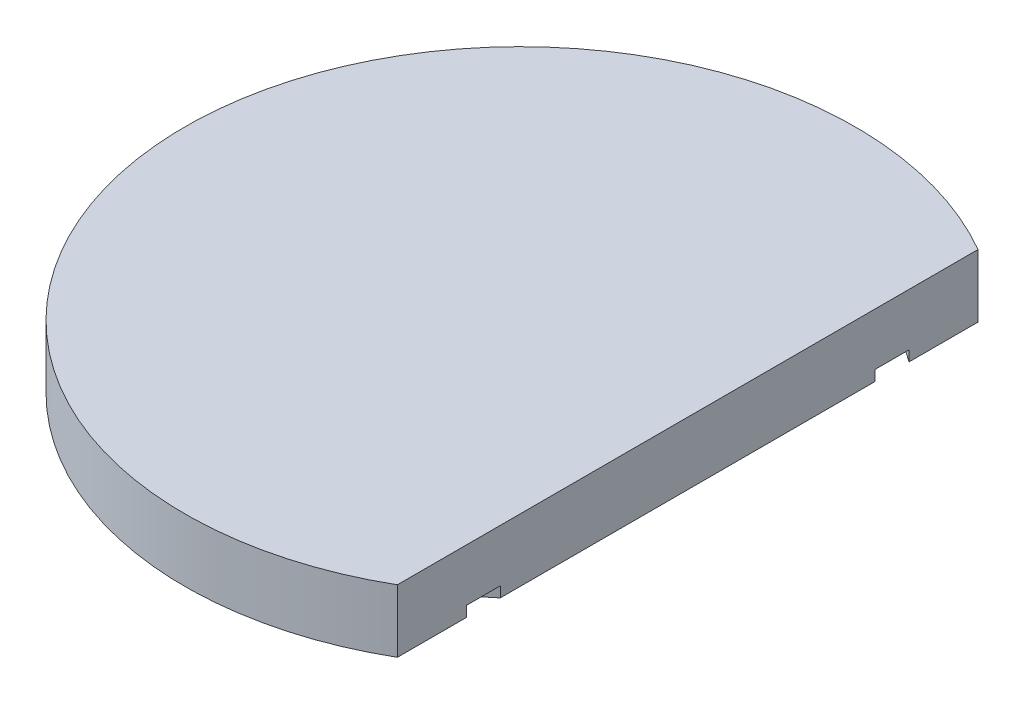
from build123d import *

# Parameters (mm, degrees)
BOSS_EXTRUDE1_DEPTH = 19.05
SKETCH2_R           = 84.1375
SKETCH2_R_2         = 76.2
CUT_EXTRUDE1_DEPTH  = 3.175


with BuildPart() as part:
    # Sketch1 → Boss-Extrude1 (new body)
    with BuildSketch(Plane(origin=(0, 0, 0), x_dir=(1, 0, 0), z_dir=(0, 1, 0))):
        with BuildLine():
            Line((50.8, -87.988181024), (50.8, 87.988181024))
            ThreePointArc((50.8, 87.988181024), (-101.6, 0), (50.8, -87.988181024))
        make_face()
    extrude(amount=BOSS_EXTRUDE1_DEPTH)

    # Sketch2 → Cut-Extrude1 (cut)
    with BuildSketch(Plane.XZ):
        Circle(SKETCH2_R)
        Circle(SKETCH2_R_2, mode=Mode.SUBTRACT)
    extrude(amount=-CUT_EXTRUDE1_DEPTH, mode=Mode.SUBTRACT)


solid = part.part
